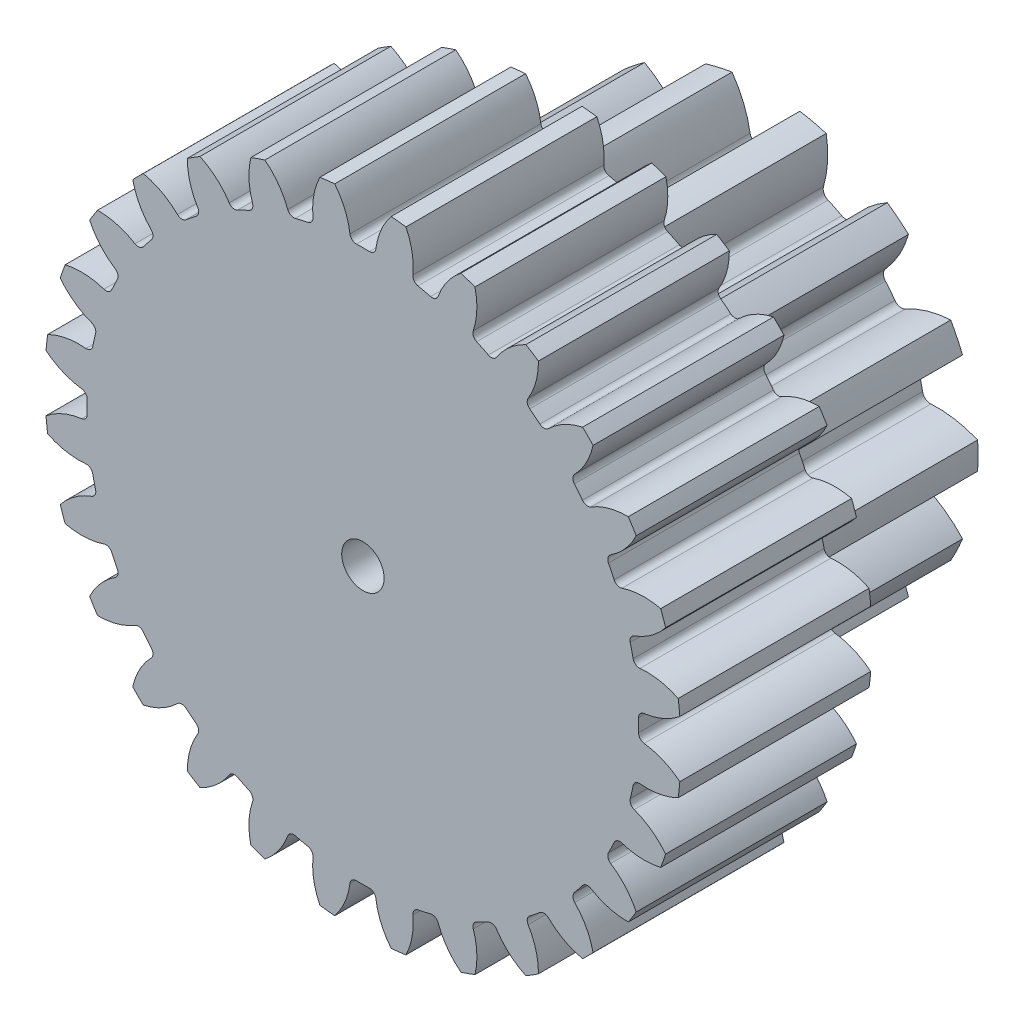
from build123d import *

# Parameters (mm, degrees)
SKETCH1_R                = 10
BOSS_EXTRUDE1_DEPTH      = 5
CUT_EXTRUDE1_DEPTH       = 16
FILLET2_R                = 0.375
CIRPATTERN1_COUNT        = 14
FILLET2_OF_CIRPATTERN1_R = 0.375
SKETCH4_R                = 15
BOSS_EXTRUDE2_DEPTH      = 9
CUT_EXTRUDE2_DEPTH       = 9
FILLET3_R                = 0.3
CIRPATTERN2_COUNT        = 28
FILLET3_OF_CIRPATTERN2_R = 0.3
SKETCH6_R                = 1
CUT_EXTRUDE3_DEPTH       = 29.41581949


with BuildPart() as part:
    # Sketch1 → Boss-Extrude1 (new, symmetric)
    with BuildSketch(Plane.XY):
        Circle(SKETCH1_R)
    extrude(amount=BOSS_EXTRUDE1_DEPTH, both=True)

    # Sketch3 → Cut-Extrude1 (cut, symmetric)
    with BuildSketch(Plane.XY):
        with BuildLine():
            ThreePointArc((-2.384983441, 10.738335718), (-1.22868019, 9.264795525), (-0.703171547, 7.466963893))
            ThreePointArc((-0.703171547, 7.466963893), (0, 7.5), (0.703171547, 7.466963893))
            ThreePointArc((0.703171547, 7.466963893), (1.22868019, 9.264795525), (2.384983441, 10.738335718))
            ThreePointArc((2.384983441, 10.738335718), (0, 11), (-2.384983441, 10.738335718))
        make_face()
    cut_extrude1 = extrude(amount=CUT_EXTRUDE1_DEPTH, both=True, mode=Mode.SUBTRACT)

    # Fillet2
    fillet2_edges = [part.edges().sort_by_distance(p)[0] for p in [
        (-0.703171547, 7.466963893, 0),
        (0.703171547, 7.466963893, 0),
    ]]
    fillet(fillet2_edges, radius=FILLET2_R)

    # CirPattern1: Cut-Extrude1 ×14 about axis
    cirpattern1_axis = Axis((0, 0, 0), (0, 0, 1))
    for i in range(1, CIRPATTERN1_COUNT):
        add(cut_extrude1.rotate(cirpattern1_axis, i * 360 / CIRPATTERN1_COUNT), mode=Mode.SUBTRACT)

    # Fillet2 of CirPattern1
    fillet2_of_cirpattern1_edges = [part.edges().sort_by_distance(p)[0] for p in [
        (-3.873329886, 6.422407305, 0),
        (-2.606258541, 7.032596705, 0),
        (-6.276327738, 4.105814185, 0),
        (-5.399487161, 5.205337491, 0),
        (-7.436221908, 0.976014211, 0),
        (-7.123281129, 2.347097347, 0),
        (-7.123281129, -2.347097347, 0),
        (-7.436221908, -0.976014211, 0),
        (-5.399487161, -5.205337491, 0),
        (-6.276327738, -4.105814185, 0),
        (-2.606258541, -7.032596705, 0),
        (-3.873329886, -6.422407305, 0),
        (0.703171547, -7.466963893, 0),
        (-0.703171547, -7.466963893, 0),
        (3.873329886, -6.422407305, 0),
        (2.606258541, -7.032596705, 0),
        (6.276327738, -4.105814185, 0),
        (5.399487161, -5.205337491, 0),
        (7.436221908, -0.976014211, 0),
        (7.123281129, -2.347097347, 0),
        (7.123281129, 2.347097347, 0),
        (7.436221908, 0.976014211, 0),
        (5.399487161, 5.205337491, 0),
        (6.276327738, 4.105814185, 0),
        (2.606258541, 7.032596705, 0),
        (3.873329886, 6.422407305, 0),
    ]]
    fillet(fillet2_of_cirpattern1_edges, radius=FILLET2_OF_CIRPATTERN1_R)


with BuildPart() as body_2:
    # Sketch4 → Boss-Extrude2 (new body)
    with BuildSketch(Plane.XY.offset(5)):
        Circle(SKETCH4_R)
    extrude(amount=BOSS_EXTRUDE2_DEPTH)

    # Sketch5 → Cut-Extrude2 (cut)
    with BuildSketch(Plane.XY.offset(14)):
        with BuildLine():
            ThreePointArc((-2.417209733, 15.816355367), (-1.118961416, 14.649371163), (-0.587024697, 12.986739468))
            ThreePointArc((-0.587024697, 12.986739468), (0, 13), (0.587024697, 12.986739468))
            ThreePointArc((0.587024697, 12.986739468), (1.118961416, 14.649371163), (2.417209733, 15.816355367))
            ThreePointArc((2.417209733, 15.816355367), (0, 16), (-2.417209733, 15.816355367))
        make_face()
    cut_extrude2 = extrude(amount=-CUT_EXTRUDE2_DEPTH, mode=Mode.SUBTRACT)

    # Fillet3
    fillet3_edges = [body_2.edges().sort_by_distance(p)[0] for p in [
        (-0.587024697, 12.986739468, 9.5),
        (0.587024697, 12.986739468, 9.5),
    ]]
    fillet(fillet3_edges, radius=FILLET3_R)

    # CirPattern2: Cut-Extrude2 ×28 about axis
    cirpattern2_axis = Axis((0, 0, 0), (0, 0, 1))
    for i in range(1, CIRPATTERN2_COUNT):
        add(cut_extrude2.rotate(cirpattern2_axis, i * 360 / CIRPATTERN2_COUNT), mode=Mode.SUBTRACT)

    # Fillet3 of CirPattern2
    fillet3_of_cirpattern2_edges = [body_2.edges().sort_by_distance(p)[0] for p in [
        (-3.462128157, 12.530509512, 9.5),
        (-2.317514634, 12.791760079, 9.5),
        (-6.163626056, 11.445947486, 9.5),
        (-5.105844103, 11.955348426, 9.5),
        (-8.556054006, 9.787437859, 9.5),
        (-7.638145229, 10.519445682, 9.5),
        (-10.519445682, 7.638145229, 9.5),
        (-9.787437859, 8.556054006, 9.5),
        (-11.955348426, 5.105844103, 9.5),
        (-11.445947486, 6.163626056, 9.5),
        (-12.791760079, 2.317514634, 9.5),
        (-12.530509512, 3.462128157, 9.5),
        (-12.986739468, -0.587024697, 9.5),
        (-12.986739468, 0.587024697, 9.5),
        (-12.530509512, -3.462128157, 9.5),
        (-12.791760079, -2.317514634, 9.5),
        (-11.445947486, -6.163626056, 9.5),
        (-11.955348426, -5.105844103, 9.5),
        (-9.787437859, -8.556054006, 9.5),
        (-10.519445682, -7.638145229, 9.5),
        (-7.638145229, -10.519445682, 9.5),
        (-8.556054006, -9.787437859, 9.5),
        (-5.105844103, -11.955348426, 9.5),
        (-6.163626056, -11.445947486, 9.5),
        (-2.317514634, -12.791760079, 9.5),
        (-3.462128157, -12.530509512, 9.5),
        (0.587024697, -12.986739468, 9.5),
        (-0.587024697, -12.986739468, 9.5),
        (3.462128157, -12.530509512, 9.5),
        (2.317514634, -12.791760079, 9.5),
        (6.163626056, -11.445947486, 9.5),
        (5.105844103, -11.955348426, 9.5),
        (8.556054006, -9.787437859, 9.5),
        (7.638145229, -10.519445682, 9.5),
        (10.519445682, -7.638145229, 9.5),
        (9.787437859, -8.556054006, 9.5),
        (11.955348426, -5.105844103, 9.5),
        (11.445947486, -6.163626056, 9.5),
        (12.791760079, -2.317514634, 9.5),
        (12.530509512, -3.462128157, 9.5),
        (12.986739468, 0.587024697, 9.5),
        (12.986739468, -0.587024697, 9.5),
        (12.530509512, 3.462128157, 9.5),
        (12.791760079, 2.317514634, 9.5),
        (11.445947486, 6.163626056, 9.5),
        (11.955348426, 5.105844103, 9.5),
        (9.787437859, 8.556054006, 9.5),
        (10.519445682, 7.638145229, 9.5),
        (7.638145229, 10.519445682, 9.5),
        (8.556054006, 9.787437859, 9.5),
        (5.105844103, 11.955348426, 9.5),
        (6.163626056, 11.445947486, 9.5),
        (2.317514634, 12.791760079, 9.5),
        (3.462128157, 12.530509512, 9.5),
    ]]
    fillet(fillet3_of_cirpattern2_edges, radius=FILLET3_OF_CIRPATTERN2_R)


with BuildPart() as cut_extrude3_tool:
    # Sketch6 → Cut-Extrude3 (new, through all)
    with BuildSketch(Plane.XY.offset(14)):
        Circle(SKETCH6_R)
    extrude(amount=-CUT_EXTRUDE3_DEPTH)


with BuildPart() as part_1:
    add(part.part)

    # Cut-Extrude3: cut by cut_extrude3_tool
    add(cut_extrude3_tool.part, mode=Mode.SUBTRACT)


with BuildPart() as body_2_1:
    add(body_2.part)

    # Cut-Extrude3: cut by cut_extrude3_tool
    add(cut_extrude3_tool.part, mode=Mode.SUBTRACT)


solid = Compound([part_1.part, body_2_1.part])
